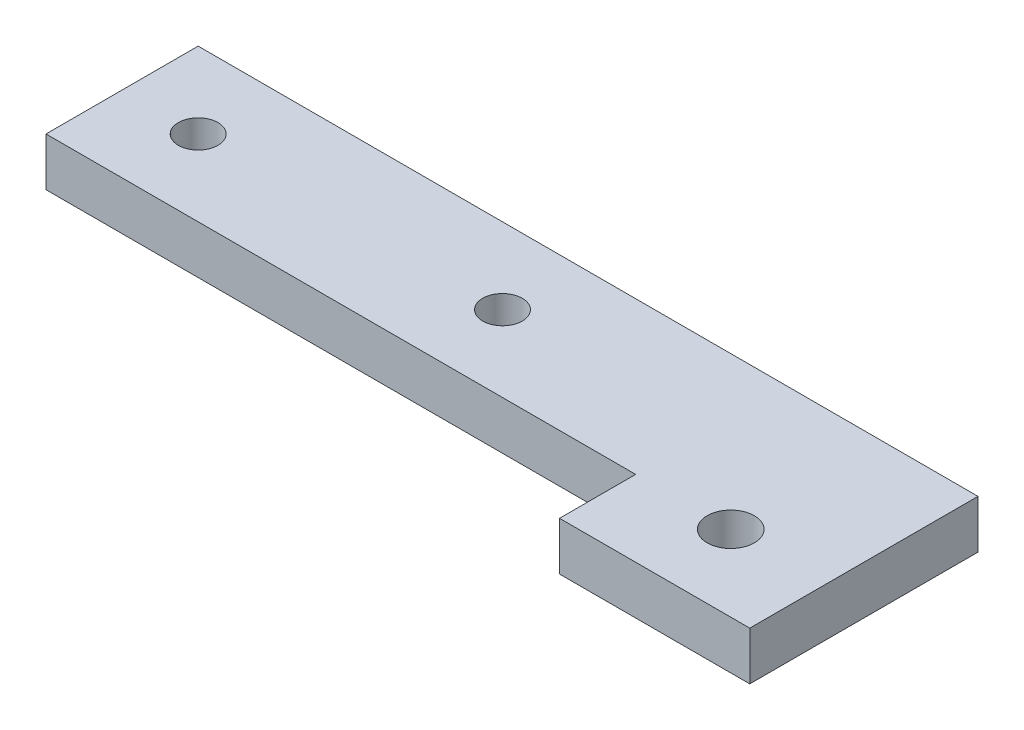
from build123d import *

# Parameters (mm, degrees)
BOSS_EXTRUDE1_DEPTH      = 3.175
BOSS_EXTRUDE1_DEPTH_BACK = 3.175
SKETCH1_R                = 3.1
SKETCH1_R_2              = 2.6


with BuildPart() as part:
    # Sketch1 → Boss-Extrude1 (new, two sides: drawn at the far end of the back side and taken through both)
    with BuildSketch(Plane(origin=(0, 0, 0), x_dir=(1, 0, 0), z_dir=(0, 1, 0)).offset(-BOSS_EXTRUDE1_DEPTH_BACK)):
        Polygon((-12.5, 0), (-12.5, -10), (12.5, -10), (12.5, 0), (12.5, 20), (-90, 20), (-90, 0), align=None)
        Circle(SKETCH1_R, mode=Mode.SUBTRACT)
        with Locations((-40, 10)):
            Circle(SKETCH1_R_2, mode=Mode.SUBTRACT)
        with Locations((-80, 10)):
            Circle(SKETCH1_R_2, mode=Mode.SUBTRACT)
    extrude(amount=BOSS_EXTRUDE1_DEPTH + BOSS_EXTRUDE1_DEPTH_BACK)


solid = part.part
